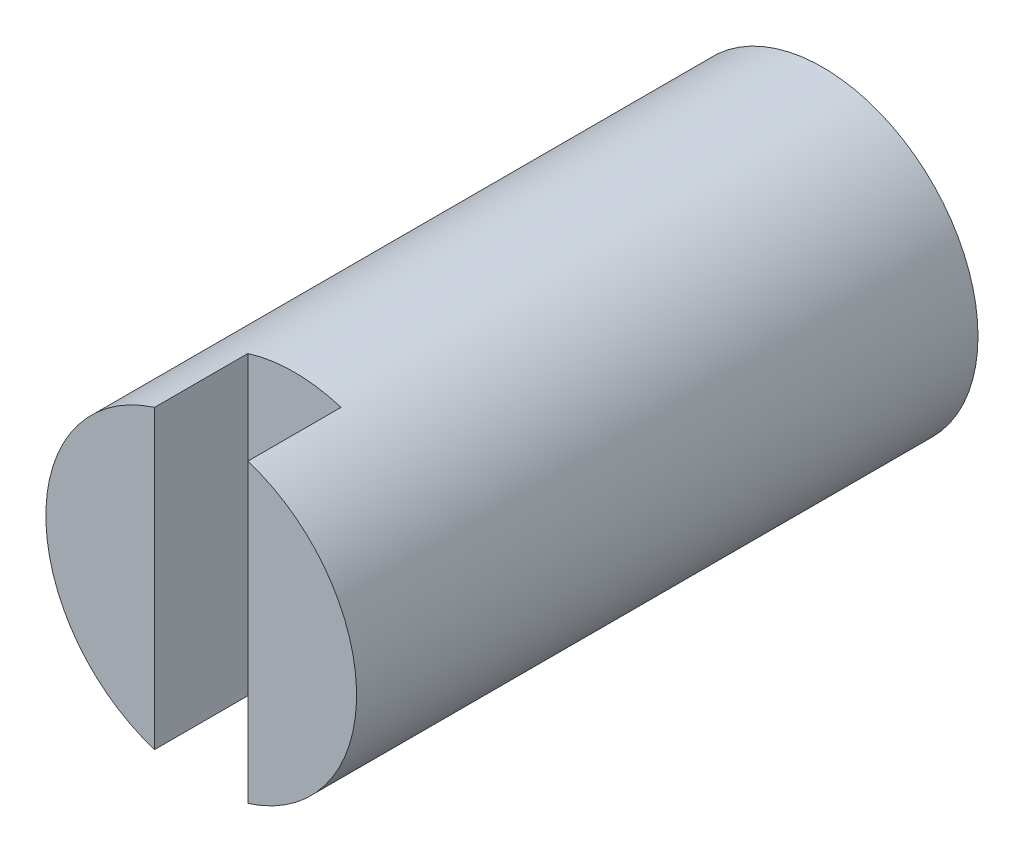
from build123d import *

# Parameters (mm, degrees)
SKETCH_1_R          = 2
EXTRUDE_1_DEPTH     = 8
SKETCH_2_W          = 1.2
SKETCH_2_H          = 4.314263921
CUT_EXTRUDE_1_DEPTH = 1.2


with BuildPart() as part:
    # 草图1 → 拉伸1 (new body)
    with BuildSketch(Plane.XY):
        Circle(SKETCH_1_R)
    extrude(amount=EXTRUDE_1_DEPTH)

    # 草图2 → 切除-拉伸1 (cut)
    with BuildSketch(Plane.XY.offset(8)):
        with Locations((0, -0.051868803)):
            Rectangle(SKETCH_2_W, SKETCH_2_H)
    extrude(amount=-CUT_EXTRUDE_1_DEPTH, mode=Mode.SUBTRACT)


solid = part.part
